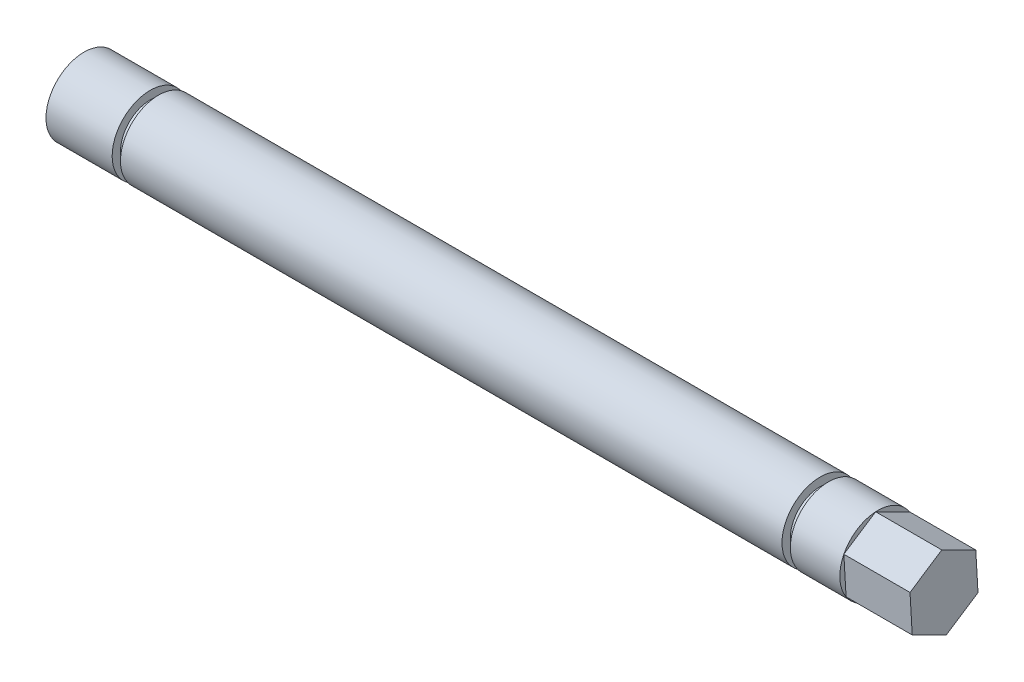
from build123d import *

# Parameters (mm, degrees)
SKETCH2_R           = 7.3025
BOSS_EXTRUDE1_DEPTH = 165.1
SKETCH3_W           = 1.6002
SKETCH3_H           = 1.6002
SKETCH4_R           = 7.3025
SKETCH4_R_2         = 5.7023
CUT_EXTRUDE1_DEPTH  = 1.6002
SKETCH5_OUTSIDE_W   = 49.882
SKETCH5_OUTSIDE_H   = 49.882
CUT_EXTRUDE2_DEPTH  = 12.7


with BuildPart() as part:
    # Sketch2 → Boss-Extrude1 (new body)
    with BuildSketch(Plane(origin=(0, 0, 0), x_dir=(0, 0, -1), z_dir=(1, 0, 0))):
        Circle(SKETCH2_R)
    extrude(amount=BOSS_EXTRUDE1_DEPTH)

    # Sketch3 → Cut-Revolve1 (revolve, cut)
    with BuildSketch(Plane.XY, mode=Mode.PRIVATE) as cut_revolve1_sk:
        with Locations((13.5001, 6.5024)):
            Rectangle(SKETCH3_W, SKETCH3_H)
    revolve(cut_revolve1_sk.sketch.rotate(Axis((0, 0, 0), (1, 0, 0)), 90), axis=Axis((0, 0, 0), (1, 0, 0)), mode=Mode.SUBTRACT)

    # Sketch4 → Cut-Extrude1 (cut)
    with BuildSketch(Plane.ZY.offset(-141.3002)):
        Circle(SKETCH4_R)
        Circle(SKETCH4_R_2, mode=Mode.SUBTRACT)
    extrude(amount=-CUT_EXTRUDE1_DEPTH, mode=Mode.SUBTRACT)

    # Sketch5 outside → Cut-Extrude2 (cut)
    with BuildSketch(Plane(origin=(165.1, 0, 0), x_dir=(0, 0, -1), z_dir=(1, 0, 0))):
        Rectangle(SKETCH5_OUTSIDE_W, SKETCH5_OUTSIDE_H)
        Polygon((6.100928401, 4.013125827), (-0.425004714, 7.290121895), (-6.525933115, 3.276996068), (-6.100928401, -4.013125827), (0.425004714, -7.290121895), (6.525933115, -3.276996068), align=None, mode=Mode.SUBTRACT)
    extrude(amount=-CUT_EXTRUDE2_DEPTH, mode=Mode.SUBTRACT)


solid = part.part
